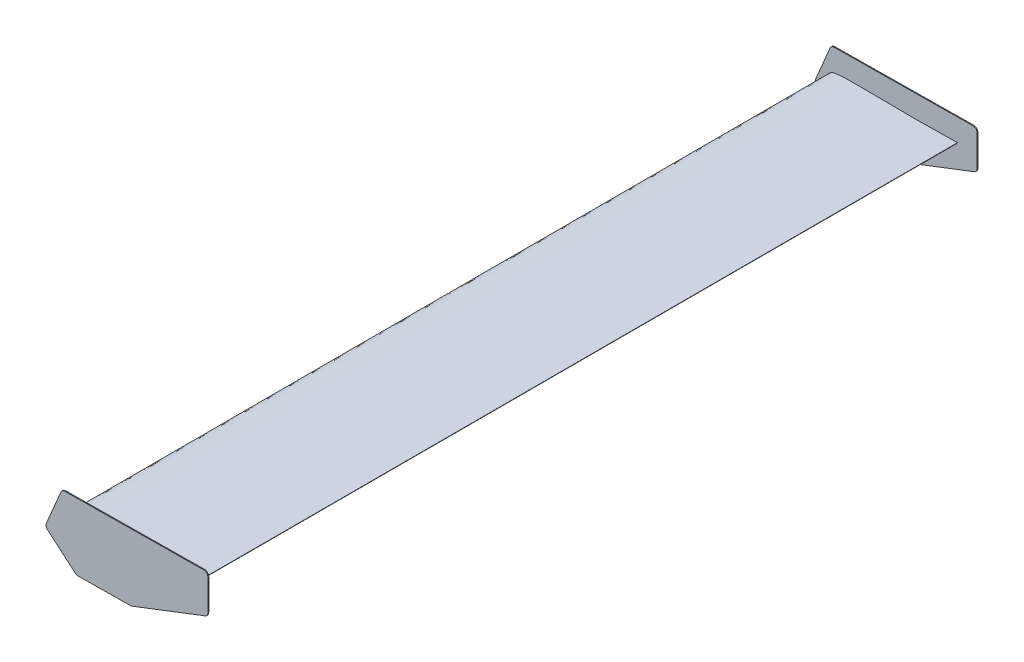
from build123d import *

# Parameters (mm, degrees)
REAR_WING_DEPTH              = 900
ENDPLATE_DEPTH               = 1
ENDPLATE_FILLET_R            = 10
ENDPLATE_FILLET_OF_MIRROR3_R = 10


with BuildPart() as part:
    # AirfoilSketch → Rear Wing (new, symmetric)
    with BuildSketch(Plane.XY):
        with BuildLine():
            Line((299.817501451, 10.469857858), (299.843709654, 9.690298283))
            add(Edge.make_bspline(
                [(299.843709654, 9.690298283), (294.897371675, 8.163528381), (285.028566091, 5.117356565), (265.241620881, -0.483296225), (240.473223163, -6.76904161), (210.641802762, -13.147354787), (180.801099732, -18.556733289), (150.901265807, -22.704852232), (120.964329456, -25.671511435), (95.918328704, -26.533363513), (75.873468384, -25.822140671), (60.793176851, -24.504681697), (45.651340948, -22.323208843), (33.070045823, -19.510438605), (22.96532445, -16.582185182), (15.32527733, -13.753926359), (8.78272888, -10.637415352), (3.067021741, -6.838570757), (-2.007421927, -0.590375041), (3.072263632, 4.489362316), (8.359083437, 6.594051401), (14.688710715, 8.107455226), (22.19336002, 9.021020637), (32.183896024, 9.824885002), (44.685299556, 10.210119952), (59.694314487, 10.294629797), (74.705502685, 9.999430489), (94.725717409, 9.736577533), (119.747764534, 9.376765647), (149.774348493, 9.258456216), (179.795480369, 9.015439888), (209.813246031, 8.957972507), (239.823941693, 9.182327312), (264.825396651, 9.62450242), (284.823207899, 10.034476428), (294.819493559, 10.324733327), (299.817501451, 10.469857858)],
                knots=[0, 0, 0, 0, 0.025304886, 0.050487653, 0.100520433, 0.150190716, 0.199586607, 0.248740009, 0.297715539, 0.346600594, 0.371102737, 0.395726297, 0.420570145, 0.445825119, 0.458702216, 0.471919982, 0.485786003, 0.493461051, 0.506863029, 0.51614777, 0.522766003, 0.535269014, 0.547551134, 0.559786371, 0.584228898, 0.60868081, 0.633151284, 0.657621757, 0.706558114, 0.75548187, 0.804405627, 0.853320224, 0.902221408, 0.951113136, 0.975557228, 1, 1, 1, 1], degree=3))
        make_face()
    extrude(amount=REAR_WING_DEPTH, both=True)

    # Endplate Sketch → Endplate (add, symmetric)
    with BuildSketch(Plane.XY.offset(900)):
        Polygon((4.198364617, 59.406656961), (-35.29092082, -33.850525596), (38.257501257, -96.733844985), (166.27509038, -95.421105135), (345.667321655, -26.31860721), (345.667321655, 62.908206322), align=None)
    endplate = extrude(amount=ENDPLATE_DEPTH, both=True)

    # Endplate Fillet
    endplate_fillet_edges = [part.edges().sort_by_distance(p)[0] for p in [
        (345.667321655, 62.908206322, 900),
        (4.198364617, 59.406656961, 900),
        (-35.29092082, -33.850525596, 900),
        (38.257501257, -96.733844985, 900),
        (166.27509038, -95.421105135, 900),
        (345.667321655, -26.31860721, 900),
    ]]
    fillet(endplate_fillet_edges, radius=ENDPLATE_FILLET_R)

    # Mirror3: Endplate across plane
    add(endplate.mirror(Plane.XY))

    # Endplate Fillet of Mirror3
    endplate_fillet_of_mirror3_edges = [part.edges().sort_by_distance(p)[0] for p in [
        (345.667321655, 62.908206322, -900),
        (4.198364617, 59.406656961, -900),
        (-35.29092082, -33.850525596, -900),
        (38.257501257, -96.733844985, -900),
        (166.27509038, -95.421105135, -900),
        (345.667321655, -26.31860721, -900),
    ]]
    fillet(endplate_fillet_of_mirror3_edges, radius=ENDPLATE_FILLET_OF_MIRROR3_R)


solid = part.part
